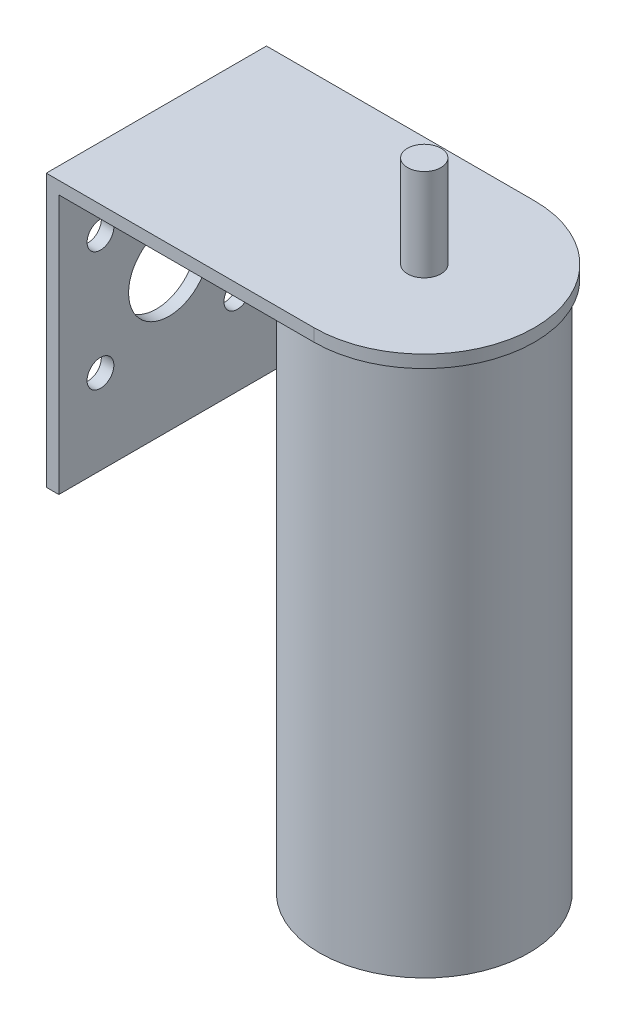
from build123d import *

# Parameters (mm, degrees)
SKETCH1_R           = 12.5
BOSS_EXTRUDE1_DEPTH = 65
SKETCH3_R           = 2
BOSS_EXTRUDE2_DEPTH = 11
BOSS_EXTRUDE3_DEPTH = 1.5
SKETCH5_W           = 1.5
SKETCH5_H           = 26.3
BOSS_EXTRUDE4_DEPTH = 31
SKETCH6_R           = 4.818685959
SKETCH6_R_2         = 1.6
CUT_EXTRUDE1_DEPTH  = 11


with BuildPart() as part:
    # Sketch1 → Boss-Extrude1 (new body)
    with BuildSketch(Plane(origin=(0, 0, 0), x_dir=(1, 0, 0), z_dir=(0, 1, 0))):
        with Locations(Location((0, 0, 0), (0, 0, 270))):
            Circle(SKETCH1_R)
    extrude(amount=BOSS_EXTRUDE1_DEPTH)

    # Sketch3 → Boss-Extrude2 (add)
    with BuildSketch(Plane(origin=(0, 65, 0), x_dir=(1, 0, 0), z_dir=(0, 1, 0))):
        with Locations(Location((0, 0, 0), (0, 0, 270))):
            Circle(SKETCH3_R)
    extrude(amount=BOSS_EXTRUDE2_DEPTH)

    # Sketch4 → Boss-Extrude3 (add)
    with BuildSketch(Plane(origin=(0, 65, 0), x_dir=(1, 0, 0), z_dir=(0, 1, 0))):
        with BuildLine():
            Line((0, 13.15), (-32, 13.15))
            Line((-32, 13.15), (-32, -13.15))
            Line((-32, -13.15), (0, -13.15))
            ThreePointArc((0, -13.15), (13.15, 0), (0, 13.15))
        make_face()
    extrude(amount=-BOSS_EXTRUDE3_DEPTH)

    # Sketch5 → Boss-Extrude4 (add)
    with BuildSketch(Plane.XZ.offset(-63.5)):
        with Locations((-31.25, 0)):
            Rectangle(SKETCH5_W, SKETCH5_H)
    extrude(amount=BOSS_EXTRUDE4_DEPTH)

    # Sketch6 → Cut-Extrude1 (cut)
    with BuildSketch(Plane.ZY.offset(32)):
        with Locations((0, 49.181314041)):
            Circle(SKETCH6_R)
        with Locations((-8.175, 56.9)):
            Circle(SKETCH6_R_2)
        with Locations((8.175, 56.9)):
            Circle(SKETCH6_R_2)
        with Locations((8.175, 42.6)):
            Circle(SKETCH6_R_2)
        with Locations((-8.175, 42.6)):
            Circle(SKETCH6_R_2)
    extrude(amount=-CUT_EXTRUDE1_DEPTH, mode=Mode.SUBTRACT)


solid = part.part
